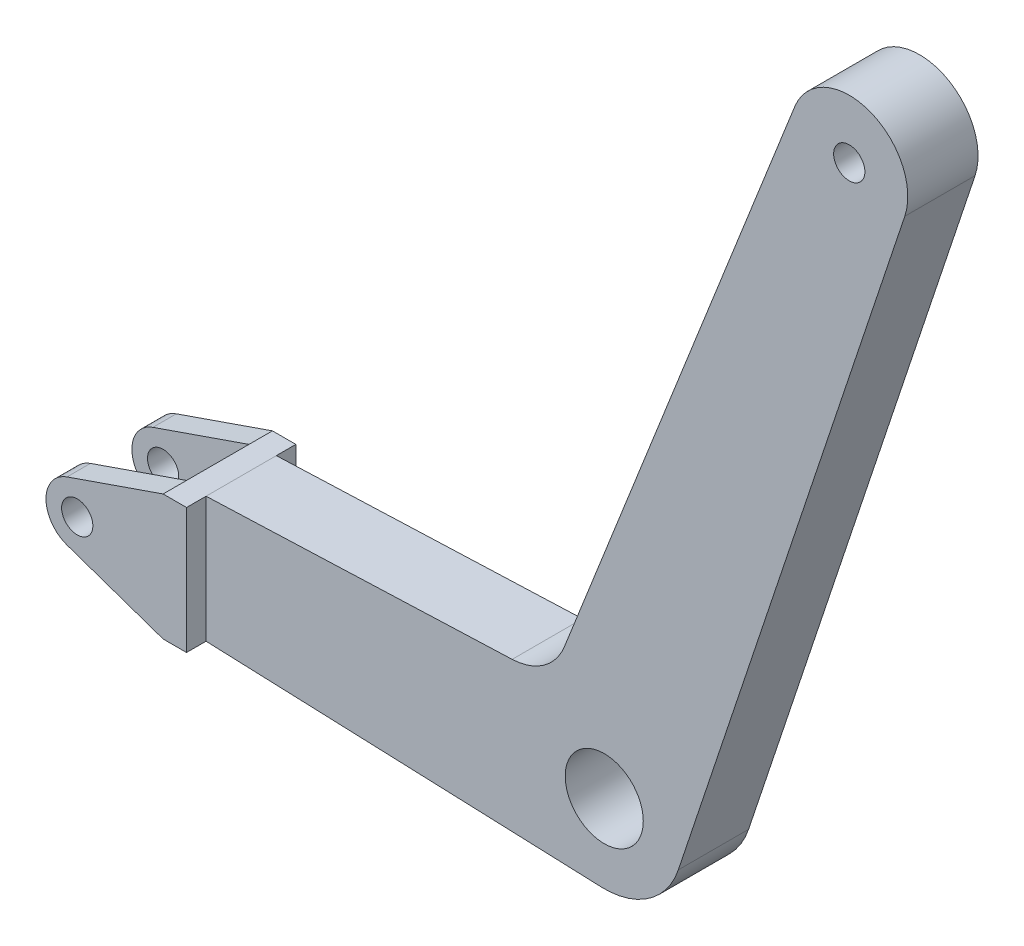
from build123d import *

# Parameters (mm, degrees)
EXTRUDE_1_DEPTH     = 18
SKETCH_2_R          = 4
SKETCH_2_R_2        = 10
CUT_EXTRUDE_1_DEPTH = 18
SKETCH_4_W          = 33.000030669
SKETCH_4_H          = 62.878436815
CUT_EXTRUDE_2_DEPTH = 60
EXTRUDE_2_DEPTH     = 6
EXTRUDE_START       = -5
EXTRUDE_3_DEPTH     = 6
EXTRUDE_START_2     = 17
EXTRUDE_4_DEPTH     = 6
SKETCH_7_R          = 4
CUT_EXTRUDE_3_DEPTH = 30


with BuildPart() as part:
    # 草图1 → 凸台-拉伸1 (new body)
    with BuildSketch(Plane.XY):
        with BuildLine():
            Line((48.810330778, 177.946063765), (-10.210076964, 28.583512616))
            ThreePointArc((-10.210076964, 28.583512616), (-15.488001892, 21.85715805), (-23.583519409, 19.107079247))
            Line((-23.583519409, 19.107079247), (-130.576923077, 14.988901219))
            ThreePointArc((-130.576923077, 14.988901219), (-145, 0), (-130.576923077, -14.988901219))
            Line((-130.576923077, -14.988901219), (-0.769230769, -19.985201626))
            ThreePointArc((-0.769230769, -19.985201626), (11.379442316, -16.447136303), (18.973261361, -6.325768991))
            Line((18.973261361, -6.325768991), (76.990642321, 167.689269171))
            ThreePointArc((76.990642321, 167.689269171), (67.89099845, 186.528985226), (48.810330778, 177.946063765))
        make_face()
    extrude(amount=EXTRUDE_1_DEPTH)

    # 草图2 → 切除-拉伸1 (cut)
    with BuildSketch(Plane.XY):
        with Locations((62.7606963, 172.433595914)):
            Circle(SKETCH_2_R)
        Circle(SKETCH_2_R_2)
    extrude(amount=CUT_EXTRUDE_1_DEPTH, mode=Mode.SUBTRACT)

    # 草图4 → 切除-拉伸2 (cut)
    with BuildSketch(Plane.ZY.offset(102)):
        with Locations((8.194839776, -6.074779021)):
            Rectangle(SKETCH_4_W, SKETCH_4_H)
    extrude(amount=CUT_EXTRUDE_2_DEPTH, mode=Mode.SUBTRACT)

    # 草图5 → 凸台-拉伸2 (add)
    with BuildSketch(Plane.ZY.offset(102)):
        Polygon((9, -16.088827501), (-5, -16.088827501), (-5, 16.088827501), (9, 16.088827501), (23, 16.088827501), (23, -16.088827501), align=None)
    extrude(amount=EXTRUDE_2_DEPTH)

    # 草图6 → 凸台-拉伸3 (add)
    with BuildSketch(Plane.XY.offset(EXTRUDE_START)):
        with BuildLine():
            Line((-108, 16.088827501), (-132.619002915, 7.559282635))
            ThreePointArc((-132.619002915, 7.559282635), (-138.000120638, 0), (-132.619002915, -7.559282635))
            Line((-132.619002915, -7.559282635), (-108, -16.088827501))
            Line((-108, -16.088827501), (-108, 16.088827501))
        make_face()
    extrude(amount=EXTRUDE_3_DEPTH)

    # 草图6<2> → 凸台-拉伸4 (add)
    with BuildSketch(Plane.XY.offset(EXTRUDE_START_2)):
        with BuildLine():
            Line((-108, 16.088827501), (-132.619002915, 7.559282635))
            ThreePointArc((-132.619002915, 7.559282635), (-138.000120638, 0), (-132.619002915, -7.559282635))
            Line((-132.619002915, -7.559282635), (-108, -16.088827501))
            Line((-108, -16.088827501), (-108, 16.088827501))
        make_face()
    extrude(amount=EXTRUDE_4_DEPTH)

    # 草图7 → 切除-拉伸3 (cut, symmetric)
    with BuildSketch(Plane.XY):
        with Locations((-130, 0)):
            Circle(SKETCH_7_R)
    extrude(amount=CUT_EXTRUDE_3_DEPTH, both=True, mode=Mode.SUBTRACT)


solid = part.part
